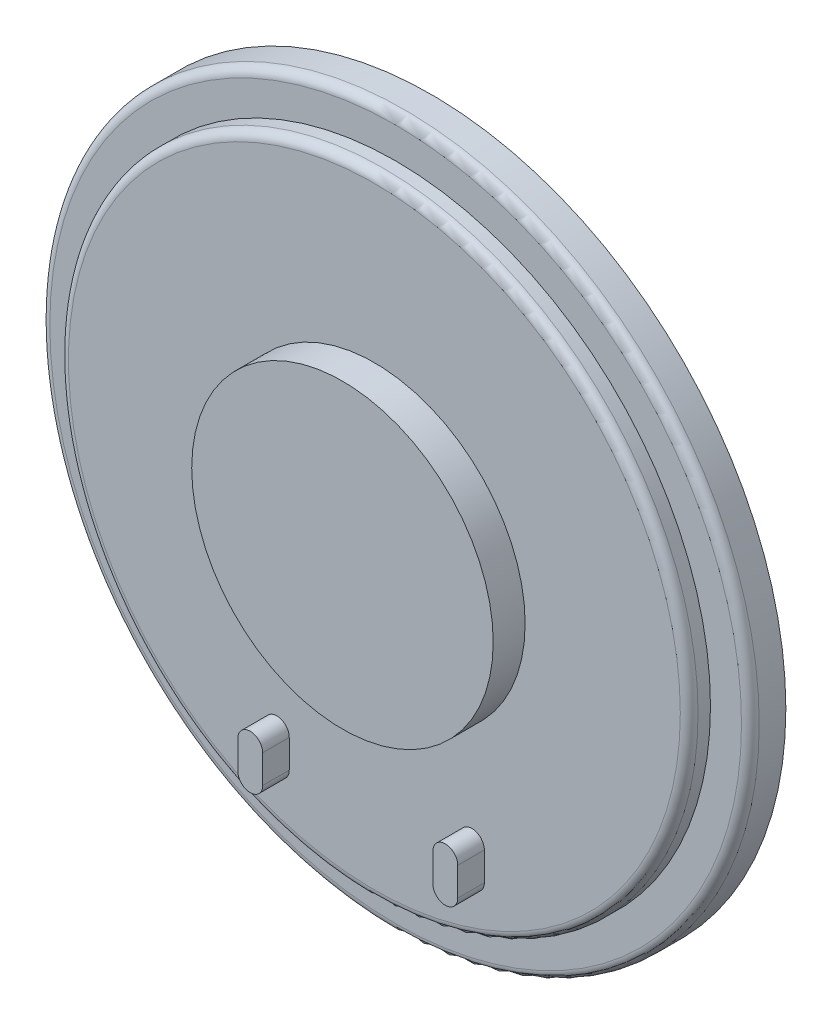
from build123d import *

# Parameters (mm, degrees)
SKETCH_1_R          = 20
EXTRUDE_1_DEPTH     = 5
SKETCH_2_OUTSIDE_W  = 53.358
SKETCH_2_OUTSIDE_H  = 53.358
SKETCH_2_OUTSIDE_R  = 17.75
CUT_EXTRUDE_1_DEPTH = 3
SKETCH_3_OUTSIDE_W  = 53.358
SKETCH_3_OUTSIDE_H  = 53.358
SKETCH_3_OUTSIDE_R  = 8.5
CUT_EXTRUDE_2_DEPTH = 1.8
CUT_EXTRUDE_START   = -1.8
SKETCH_4_R          = 17.75
CUT_EXTRUDE_3_DEPTH = 1.8
FILLET_1_R          = 1.5
FILLET_2_R          = 0.5
FILLET_3_R          = 0.5
EXTRUDE_999_DEPTH   = 1.5


with BuildPart() as part:
    # 草图1 → 拉伸1 (new body)
    with BuildSketch(Plane.XY):
        Circle(SKETCH_1_R)
    extrude(amount=EXTRUDE_1_DEPTH)

    # 草图2 outside → 切除-拉伸1 (cut)
    with BuildSketch(Plane.XY.offset(5)):
        Rectangle(SKETCH_2_OUTSIDE_W, SKETCH_2_OUTSIDE_H)
        Circle(SKETCH_2_OUTSIDE_R, mode=Mode.SUBTRACT)
    extrude(amount=-CUT_EXTRUDE_1_DEPTH, mode=Mode.SUBTRACT)

    # 草图3 outside → 切除-拉伸2 (cut)
    with BuildSketch(Plane.XY.offset(5)):
        Rectangle(SKETCH_3_OUTSIDE_W, SKETCH_3_OUTSIDE_H)
        Circle(SKETCH_3_OUTSIDE_R, mode=Mode.SUBTRACT)
    extrude(amount=-CUT_EXTRUDE_2_DEPTH, mode=Mode.SUBTRACT)

    # 草图4 → 切除-拉伸3 (cut)
    with BuildSketch(Plane(origin=(0, 0, 0), x_dir=(-1, 0, 0), z_dir=(0, 0, -1)).offset(CUT_EXTRUDE_START)):
        with Locations(Location((0, 0, 0), (0, 0, 180))):
            Circle(SKETCH_4_R)
    extrude(amount=CUT_EXTRUDE_3_DEPTH, mode=Mode.SUBTRACT)

    # 圆角1
    fillet_1_edges = [part.edges().sort_by_distance(p)[0] for p in [
        (-17.75, 0, 0),
    ]]
    fillet(fillet_1_edges, radius=FILLET_1_R)

    # 圆角2
    fillet_2_edges = [part.edges().sort_by_distance(p)[0] for p in [
        (-20, 0, 2),
    ]]
    fillet(fillet_2_edges, radius=FILLET_2_R)

    # 圆角3
    fillet_3_edges = [part.edges().sort_by_distance(p)[0] for p in [
        (-17.75, 0, 3.2),
    ]]
    fillet(fillet_3_edges, radius=FILLET_3_R)

    # 草图5 → Extrude 999 (add)
    with BuildSketch(Plane.XY.offset(3.2)):
        with BuildLine():
            Line((-4.8, -12.2), (-4.8, -13.8))
            ThreePointArc((-4.8, -13.8), (-5.5, -14.5), (-6.2, -13.8))
            Line((-6.2, -13.8), (-6.2, -12.2))
            ThreePointArc((-6.2, -12.2), (-5.5, -11.5), (-4.8, -12.2))
        make_face()
        with BuildLine():
            Line((4.8, -12.2), (4.8, -13.8))
            ThreePointArc((4.8, -13.8), (5.5, -14.5), (6.2, -13.8))
            Line((6.2, -13.8), (6.2, -12.2))
            ThreePointArc((6.2, -12.2), (5.5, -11.5), (4.8, -12.2))
        make_face()
    extrude(amount=EXTRUDE_999_DEPTH)


solid = part.part
